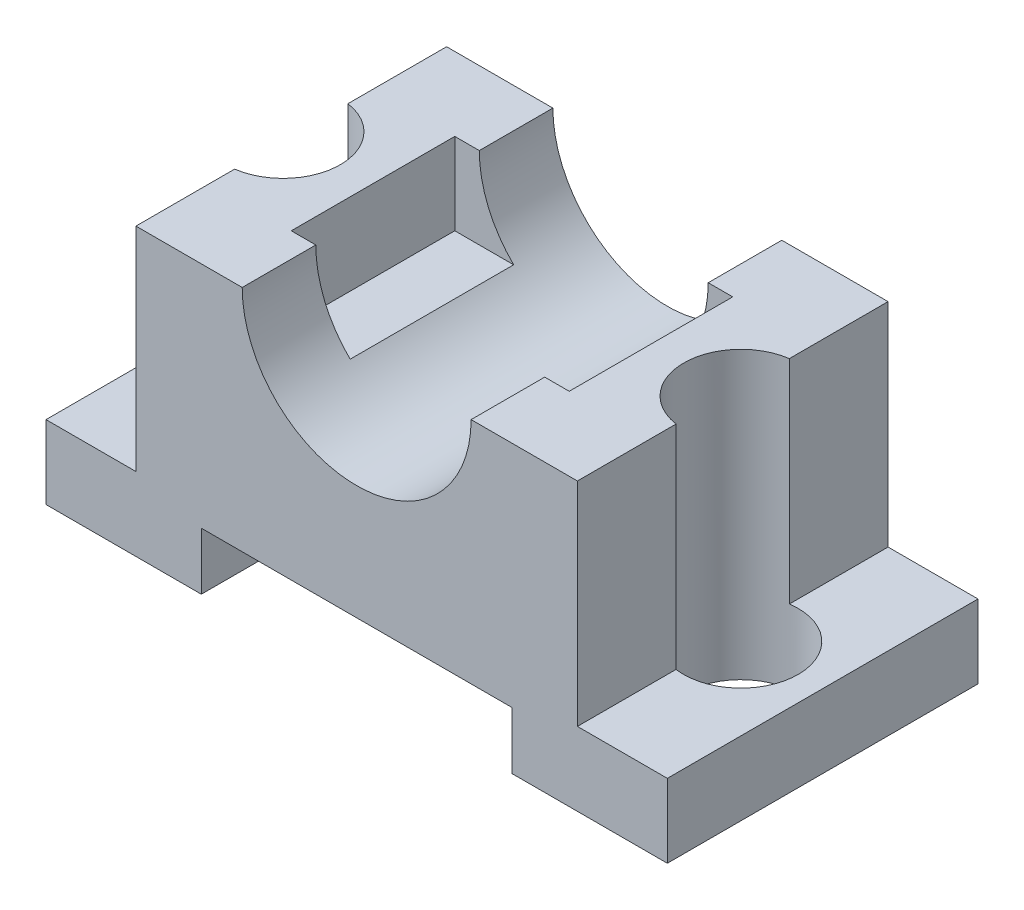
from build123d import *

# Parameters (mm, degrees)
EXTRUDE_1_DEPTH          = 19
CUT_EXTRUDE_1_DEPTH      = 50.809637622
CUT_EXTRUDE_1_DEPTH_BACK = 50.809637622
SKETCH_2_R               = 7
CUT_EXTRUDE_2_DEPTH      = 56.045435778
CUT_EXTRUDE_2_DEPTH_BACK = 10
SKETCH_3_W               = 34
SKETCH_3_H               = 20


with BuildPart() as part:
    # 草图1 → 凸台-拉伸1 (new, symmetric)
    with BuildSketch(Plane.XY):
        with BuildLine():
            ThreePointArc((-14, 35), (0, 21), (14, 35))
            Line((14, 35), (27, 35))
            Line((27, 35), (27, 9))
            Line((27, 9), (38, 9))
            Line((38, 9), (38, 0))
            Line((38, 0), (19, 0))
            Line((19, 0), (19, 7))
            Line((19, 7), (-19, 7))
            Line((-19, 7), (-19, 0))
            Line((-19, 0), (-38, 0))
            Line((-38, 0), (-38, 9))
            Line((-38, 9), (-27, 9))
            Line((-27, 9), (-27, 35))
            Line((-27, 35), (-14, 35))
        make_face()
    extrude(amount=EXTRUDE_1_DEPTH, both=True)

    # 草图2 → 切除-拉伸1 (cut, two sides: drawn at the far end of the back side and taken through both)
    with BuildSketch(Plane(origin=(0, 9, 0), x_dir=(1, 0, 0), z_dir=(0, 1, 0)).offset(-CUT_EXTRUDE_1_DEPTH_BACK)):
        with Locations(Location((28, 0, 0), (0, 0, 270))):
            Circle(SKETCH_2_R)
        with Locations(Location((-28, 0, 0), (0, 0, 278.213210702))):
            Circle(SKETCH_2_R)
    extrude(amount=CUT_EXTRUDE_1_DEPTH + CUT_EXTRUDE_1_DEPTH_BACK, mode=Mode.SUBTRACT)

    # 草图3 → 切除-拉伸2 (cut, two sides: drawn at the far end of the back side and taken through both)
    with BuildSketch(Plane(origin=(0, 35, 0), x_dir=(1, 0, 0), z_dir=(0, 1, 0)).offset(-CUT_EXTRUDE_2_DEPTH_BACK)):
        Rectangle(SKETCH_3_W, SKETCH_3_H)
    extrude(amount=CUT_EXTRUDE_2_DEPTH + CUT_EXTRUDE_2_DEPTH_BACK, mode=Mode.SUBTRACT)


solid = part.part
